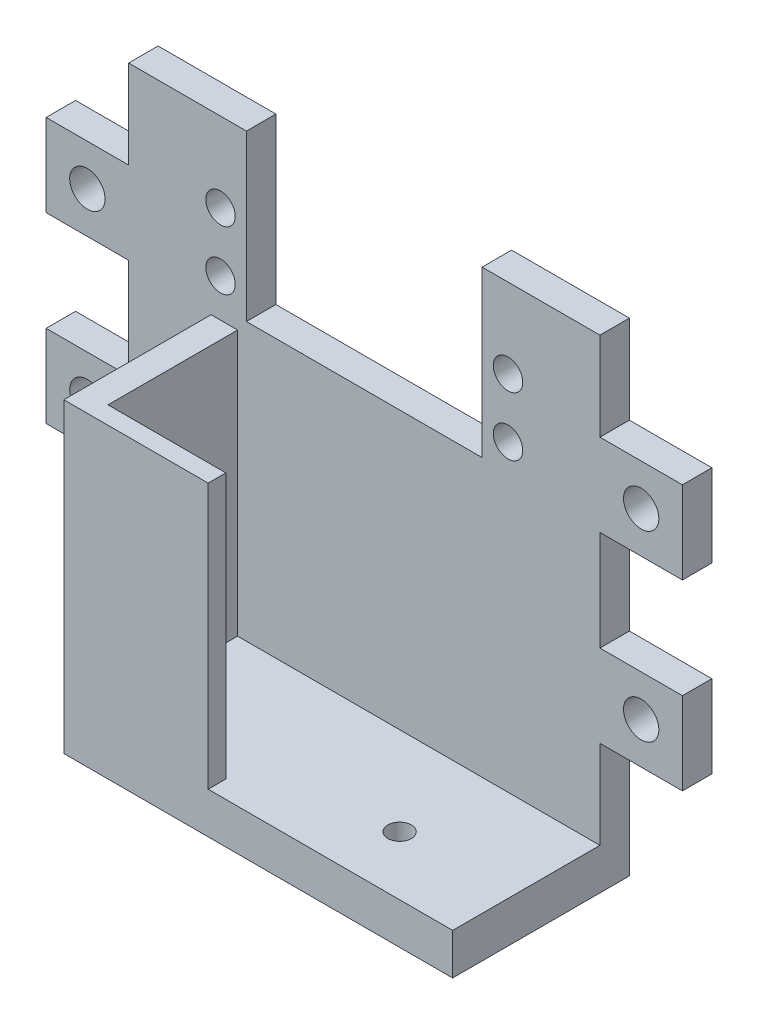
from build123d import *

# Parameters (mm, degrees)
ESQUISSE1_W             = 80
ESQUISSE1_H             = 75
ESQUISSE1_W_2           = 40
ESQUISSE1_H_2           = 19
ESQUISSE1_W_3           = 14
ESQUISSE1_H_3           = 14
BOSS_EXTRU_1_DEPTH      = 5
ENL_V_MAT_EXTRU_1_REACH = 122.358
ESQUISSE2_R             = 3
ESQUISSE3_W             = 80
ESQUISSE3_H             = 7
BOSS_EXTRU_2_DEPTH      = 30
ENL_V_MAT_EXTRU_2_REACH = 125.94
ESQUISSE4_R             = 2.5
ENL_V_MAT_EXTRU_3_REACH = 125.94
ESQUISSE5_W             = 40
ESQUISSE5_H             = 9
ESQUISSE6_R             = 2
ENL_V_MAT_EXTRU_4_DEPTH = 4
ESQUISSE7_W             = 4.5
ESQUISSE7_H             = 45
BOSS_EXTRU_3_DEPTH      = 25
ESQUISSE8_W             = 3
ESQUISSE8_H             = 45
BOSS_EXTRU_4_DEPTH      = 20
ENL_V_MAT_EXTRU_5_REACH = 124.825
ESQUISSE9_W             = 14
ESQUISSE9_H             = 15
ENL_V_MAT_EXTRU_9_REACH = 125.94
ESQUISSE11_W            = 14
ESQUISSE11_H            = 7


with BuildPart() as part:
    # Esquisse1 → Boss.-Extru.1 (new body)
    # profile 1 of 5: a face of its own
    with BuildSketch(Plane.XY):
        with Locations((40, 37.5)):
            Rectangle(ESQUISSE1_W, ESQUISSE1_H)
        with Locations((40, 56.5)):
            Rectangle(ESQUISSE1_W_2, ESQUISSE1_H_2, mode=Mode.SUBTRACT)
    # profile 2 of 5: a face of its own
    with BuildSketch(Plane.XY):
        with Locations((-7, 53)):
            Rectangle(ESQUISSE1_W_3, ESQUISSE1_H_3)
    # profile 3 of 5: a face of its own
    with BuildSketch(Plane.XY):
        with Locations((-7, 22)):
            Rectangle(ESQUISSE1_W_3, ESQUISSE1_H_3)
    # profile 4 of 5: a face of its own
    with BuildSketch(Plane.XY):
        with Locations((87, 53)):
            Rectangle(ESQUISSE1_W_3, ESQUISSE1_H_3)
    # profile 5 of 5: a face of its own
    with BuildSketch(Plane.XY):
        with Locations((87, 22)):
            Rectangle(ESQUISSE1_W_3, ESQUISSE1_H_3)
    extrude(amount=BOSS_EXTRU_1_DEPTH)

    # Esquisse2 → Enlèv. mat.-Extru.1 (cut, up to next)
    with BuildSketch(Plane.XY.offset(5), mode=Mode.PRIVATE) as enl_v_mat_extru_1_sk1:
        with Locations((-7, 53)):
            Circle(ESQUISSE2_R)
    enl_v_mat_extru_1_tool1 = extrude(enl_v_mat_extru_1_sk1.sketch, amount=-ENL_V_MAT_EXTRU_1_REACH, mode=Mode.PRIVATE) & part.part
    # Esquisse2 → Enlèv. mat.-Extru.1 (cut, up to next)
    with BuildSketch(Plane.XY.offset(5), mode=Mode.PRIVATE) as enl_v_mat_extru_1_sk2:
        with Locations((-7, 22)):
            Circle(ESQUISSE2_R)
    enl_v_mat_extru_1_tool2 = extrude(enl_v_mat_extru_1_sk2.sketch, amount=-ENL_V_MAT_EXTRU_1_REACH, mode=Mode.PRIVATE) & part.part
    # Esquisse2 → Enlèv. mat.-Extru.1 (cut, up to next)
    with BuildSketch(Plane.XY.offset(5), mode=Mode.PRIVATE) as enl_v_mat_extru_1_sk3:
        with Locations((87, 22)):
            Circle(ESQUISSE2_R)
    enl_v_mat_extru_1_tool3 = extrude(enl_v_mat_extru_1_sk3.sketch, amount=-ENL_V_MAT_EXTRU_1_REACH, mode=Mode.PRIVATE) & part.part
    # Esquisse2 → Enlèv. mat.-Extru.1 (cut, up to next)
    with BuildSketch(Plane.XY.offset(5), mode=Mode.PRIVATE) as enl_v_mat_extru_1_sk4:
        with Locations((87, 53)):
            Circle(ESQUISSE2_R)
    enl_v_mat_extru_1_tool4 = extrude(enl_v_mat_extru_1_sk4.sketch, amount=-ENL_V_MAT_EXTRU_1_REACH, mode=Mode.PRIVATE) & part.part
    add(enl_v_mat_extru_1_tool1.solids().sort_by_distance((-7, 53, 5))[0], mode=Mode.SUBTRACT)
    add(enl_v_mat_extru_1_tool2.solids().sort_by_distance((-7, 22, 5))[0], mode=Mode.SUBTRACT)
    add(enl_v_mat_extru_1_tool3.solids().sort_by_distance((87, 22, 5))[0], mode=Mode.SUBTRACT)
    add(enl_v_mat_extru_1_tool4.solids().sort_by_distance((87, 53, 5))[0], mode=Mode.SUBTRACT)

    # Esquisse3 → Boss.-Extru.2 (add)
    with BuildSketch(Plane.XY):
        with Locations((40, -3.5)):
            Rectangle(ESQUISSE3_W, ESQUISSE3_H)
    extrude(amount=BOSS_EXTRU_2_DEPTH)

    # Esquisse4 → Enlèv. mat.-Extru.2 (cut, up to next)
    with BuildSketch(Plane(origin=(0, 0, 0), x_dir=(-1, 0, 0), z_dir=(0, 0, -1)), mode=Mode.PRIVATE) as enl_v_mat_extru_2_sk1:
        with Locations((-64.4, 61.5)):
            Circle(ESQUISSE4_R)
    enl_v_mat_extru_2_tool1 = extrude(enl_v_mat_extru_2_sk1.sketch, amount=-ENL_V_MAT_EXTRU_2_REACH, mode=Mode.PRIVATE) & part.part
    # Esquisse4 → Enlèv. mat.-Extru.2 (cut, up to next)
    with BuildSketch(Plane(origin=(0, 0, 0), x_dir=(-1, 0, 0), z_dir=(0, 0, -1)), mode=Mode.PRIVATE) as enl_v_mat_extru_2_sk2:
        with Locations(Location((-15.6, 61.5, 0), (0, 0, 180))):
            Circle(ESQUISSE4_R)
    enl_v_mat_extru_2_tool2 = extrude(enl_v_mat_extru_2_sk2.sketch, amount=-ENL_V_MAT_EXTRU_2_REACH, mode=Mode.PRIVATE) & part.part
    # Esquisse4 → Enlèv. mat.-Extru.2 (cut, up to next)
    with BuildSketch(Plane(origin=(0, 0, 0), x_dir=(-1, 0, 0), z_dir=(0, 0, -1)), mode=Mode.PRIVATE) as enl_v_mat_extru_2_sk3:
        with Locations((-15.6, 51.5)):
            Circle(ESQUISSE4_R)
    enl_v_mat_extru_2_tool3 = extrude(enl_v_mat_extru_2_sk3.sketch, amount=-ENL_V_MAT_EXTRU_2_REACH, mode=Mode.PRIVATE) & part.part
    # Esquisse4 → Enlèv. mat.-Extru.2 (cut, up to next)
    with BuildSketch(Plane(origin=(0, 0, 0), x_dir=(-1, 0, 0), z_dir=(0, 0, -1)), mode=Mode.PRIVATE) as enl_v_mat_extru_2_sk4:
        with Locations(Location((-64.4, 51.5, 0), (0, 0, 180))):
            Circle(ESQUISSE4_R)
    enl_v_mat_extru_2_tool4 = extrude(enl_v_mat_extru_2_sk4.sketch, amount=-ENL_V_MAT_EXTRU_2_REACH, mode=Mode.PRIVATE) & part.part
    add(enl_v_mat_extru_2_tool1.solids().sort_by_distance((64.4, 61.5, 0))[0], mode=Mode.SUBTRACT)
    add(enl_v_mat_extru_2_tool2.solids().sort_by_distance((15.6, 61.5, 0))[0], mode=Mode.SUBTRACT)
    add(enl_v_mat_extru_2_tool3.solids().sort_by_distance((15.6, 51.5, 0))[0], mode=Mode.SUBTRACT)
    add(enl_v_mat_extru_2_tool4.solids().sort_by_distance((64.4, 51.5, 0))[0], mode=Mode.SUBTRACT)

    # Esquisse5 → Enlèv. mat.-Extru.3 (cut, up to next)
    with BuildSketch(Plane(origin=(0, 0, 0), x_dir=(-1, 0, 0), z_dir=(0, 0, -1)), mode=Mode.PRIVATE) as enl_v_mat_extru_3_sk1:
        with Locations((-40, 70.5)):
            Rectangle(ESQUISSE5_W, ESQUISSE5_H)
    enl_v_mat_extru_3_tool1 = extrude(enl_v_mat_extru_3_sk1.sketch, amount=-ENL_V_MAT_EXTRU_3_REACH, mode=Mode.PRIVATE) & part.part
    add(enl_v_mat_extru_3_tool1.solids().sort_by_distance((40, 70.5, 0))[0], mode=Mode.SUBTRACT)

    # Esquisse6 → Enlèv. mat.-Extru.4 (cut)
    with BuildSketch(Plane(origin=(0, 0, 0), x_dir=(1, 0, 0), z_dir=(0, 1, 0))):
        with Locations(Location((61, -20, 0), (0, 0, 270))):
            Circle(ESQUISSE6_R)
    extrude(amount=-ENL_V_MAT_EXTRU_4_DEPTH, mode=Mode.SUBTRACT)

    # Esquisse7 → Boss.-Extru.3 (add)
    with BuildSketch(Plane.XY.offset(5)):
        with Locations((16.25, 22.5)):
            Rectangle(ESQUISSE7_W, ESQUISSE7_H)
    extrude(amount=BOSS_EXTRU_3_DEPTH)

    # Esquisse8 → Boss.-Extru.4 (add)
    with BuildSketch(Plane(origin=(18.5, 0, 0), x_dir=(0, 0, -1), z_dir=(1, 0, 0))):
        with Locations((-28.5, 22.5)):
            Rectangle(ESQUISSE8_W, ESQUISSE8_H)
    extrude(amount=BOSS_EXTRU_4_DEPTH)

    # Esquisse9 → Enlèv. mat.-Extru.5 (cut, up to next)
    with BuildSketch(Plane.XY.offset(5), mode=Mode.PRIVATE) as enl_v_mat_extru_5_sk1:
        with Locations((7, 7.5)):
            Rectangle(ESQUISSE9_W, ESQUISSE9_H)
    enl_v_mat_extru_5_tool1 = extrude(enl_v_mat_extru_5_sk1.sketch, amount=-ENL_V_MAT_EXTRU_5_REACH, mode=Mode.PRIVATE) & part.part
    add(enl_v_mat_extru_5_tool1.solids().sort_by_distance((7, 7.5, 5))[0], mode=Mode.SUBTRACT)

    # Esquisse11 → Enlèv. mat.-Extru.9 (cut, up to next)
    with BuildSketch(Plane.XY.offset(30), mode=Mode.PRIVATE) as enl_v_mat_extru_9_sk1:
        with Locations((7, -3.5)):
            Rectangle(ESQUISSE11_W, ESQUISSE11_H)
    enl_v_mat_extru_9_tool1 = extrude(enl_v_mat_extru_9_sk1.sketch, amount=-ENL_V_MAT_EXTRU_9_REACH, mode=Mode.PRIVATE) & part.part
    add(enl_v_mat_extru_9_tool1.solids().sort_by_distance((7, -3.5, 30))[0], mode=Mode.SUBTRACT)


solid = part.part
